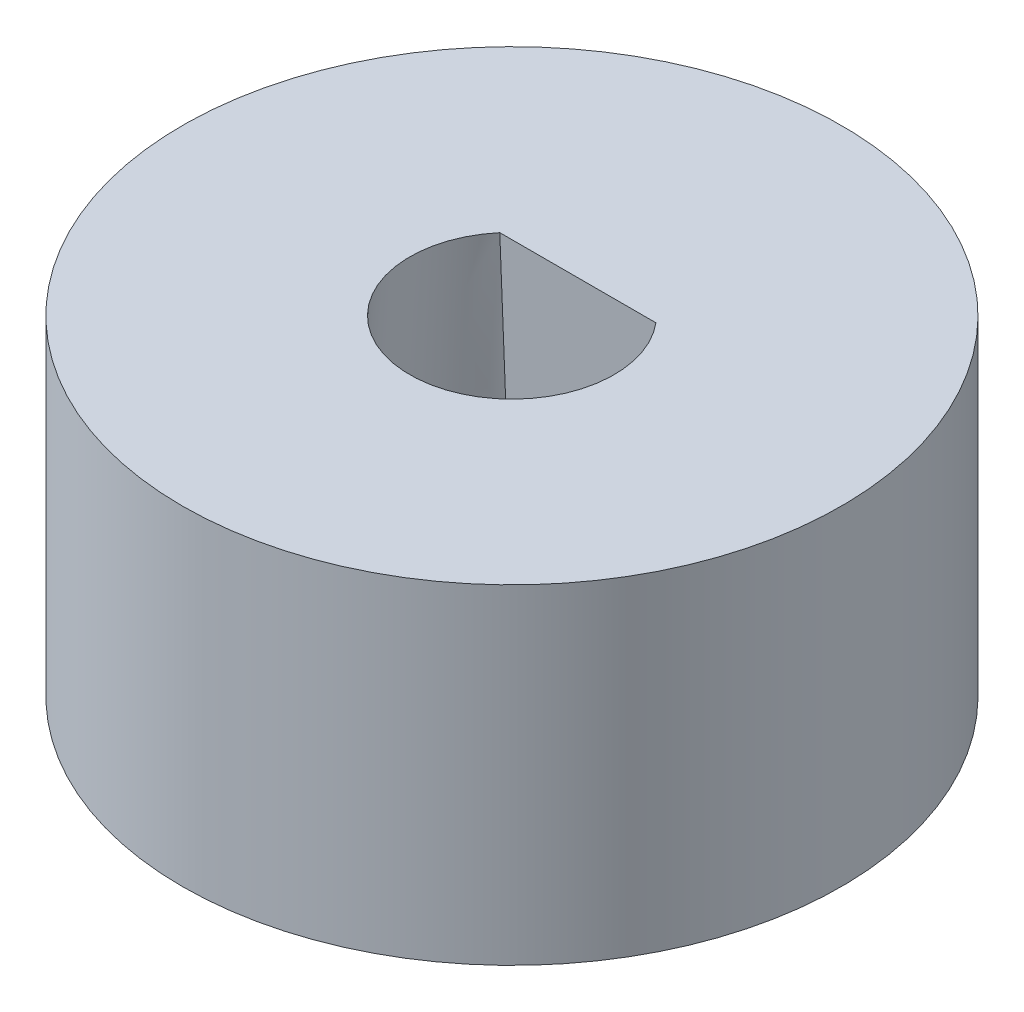
from build123d import *

# Parameters (mm, degrees)
SKETCH1_R           = 5
BOSS_EXTRUDE1_DEPTH = 5
DRAFT12_ANGLE       = -4


with BuildPart() as part:
    # Sketch1 → Boss-Extrude1 (new body)
    with BuildSketch(Plane(origin=(0, 0, 0), x_dir=(1, 0, 0), z_dir=(0, 1, 0))):
        with Locations(Location((0, 0, 0), (0, 0, 270))):
            Circle(SKETCH1_R)
        with BuildLine():
            Line((-1.184271928, 1), (1.184271928, 1))
            ThreePointArc((1.184271928, 1), (0, -1.55), (-1.184271928, 1))
        make_face(mode=Mode.SUBTRACT)
    extrude(amount=BOSS_EXTRUDE1_DEPTH)

    # Draft12
    draft12_faces = [part.faces().sort_by_distance(p)[0] for p in [
        (0, 2.5, 1.55),
        (0, 2.5, -1),
    ]]
    draft(draft12_faces, Plane.ZX.offset(5), DRAFT12_ANGLE)


solid = part.part
